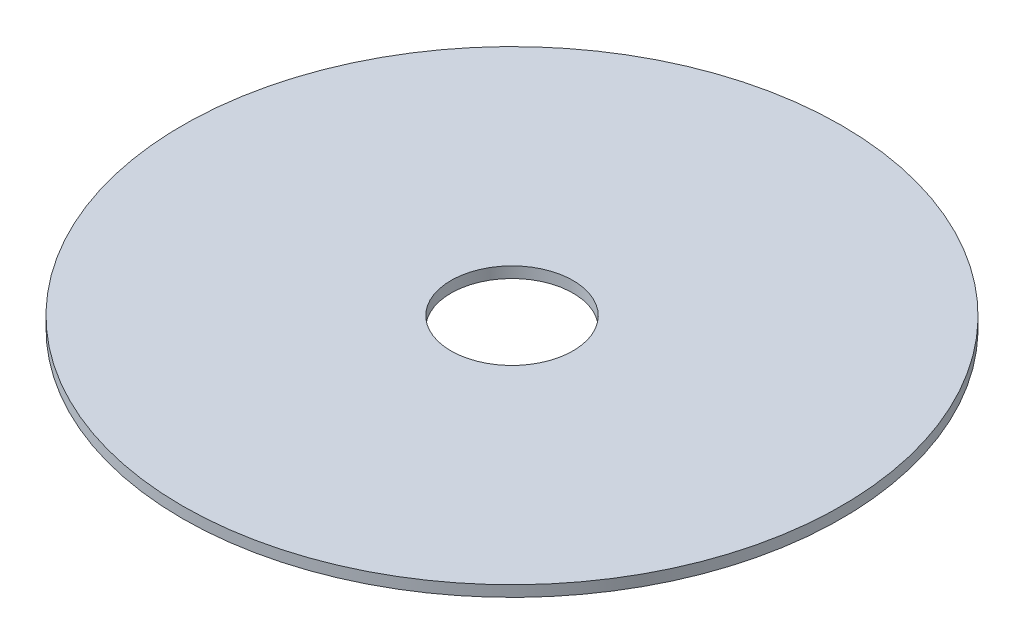
from build123d import *

# Parameters (mm, degrees)
CROQUIS1_R              = 60
CROQUIS1_R_2            = 11.11
SALIENTE_EXTRUIR1_DEPTH = 2


with BuildPart() as part:
    # Croquis1 → Saliente-Extruir1 (new body)
    with BuildSketch(Plane(origin=(0, 0, 0), x_dir=(1, 0, 0), z_dir=(0, 1, 0))):
        with Locations(Location((0, 0, 0), (0, 0, 270))):
            Circle(CROQUIS1_R)
        with Locations(Location((0, 0, 0), (0, 0, 270))):
            Circle(CROQUIS1_R_2, mode=Mode.SUBTRACT)
    extrude(amount=SALIENTE_EXTRUIR1_DEPTH)


solid = part.part
